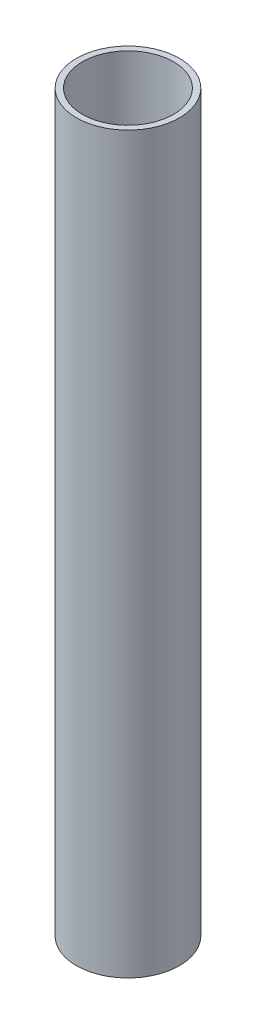
from build123d import *

# Parameters (mm, degrees)
SKETCH1_R           = 20
SKETCH1_R_2         = 17.7
BOSS_EXTRUDE1_DEPTH = 285


with BuildPart() as part:
    # Sketch1 → Boss-Extrude1 (new body)
    with BuildSketch(Plane(origin=(0, 0, 0), x_dir=(1, 0, 0), z_dir=(0, 1, 0))):
        with Locations(Location((0, 0, 0), (0, 0, 270))):
            Circle(SKETCH1_R)
        with Locations(Location((0, 0, 0), (0, 0, 270))):
            Circle(SKETCH1_R_2, mode=Mode.SUBTRACT)
    extrude(amount=BOSS_EXTRUDE1_DEPTH)


solid = part.part
